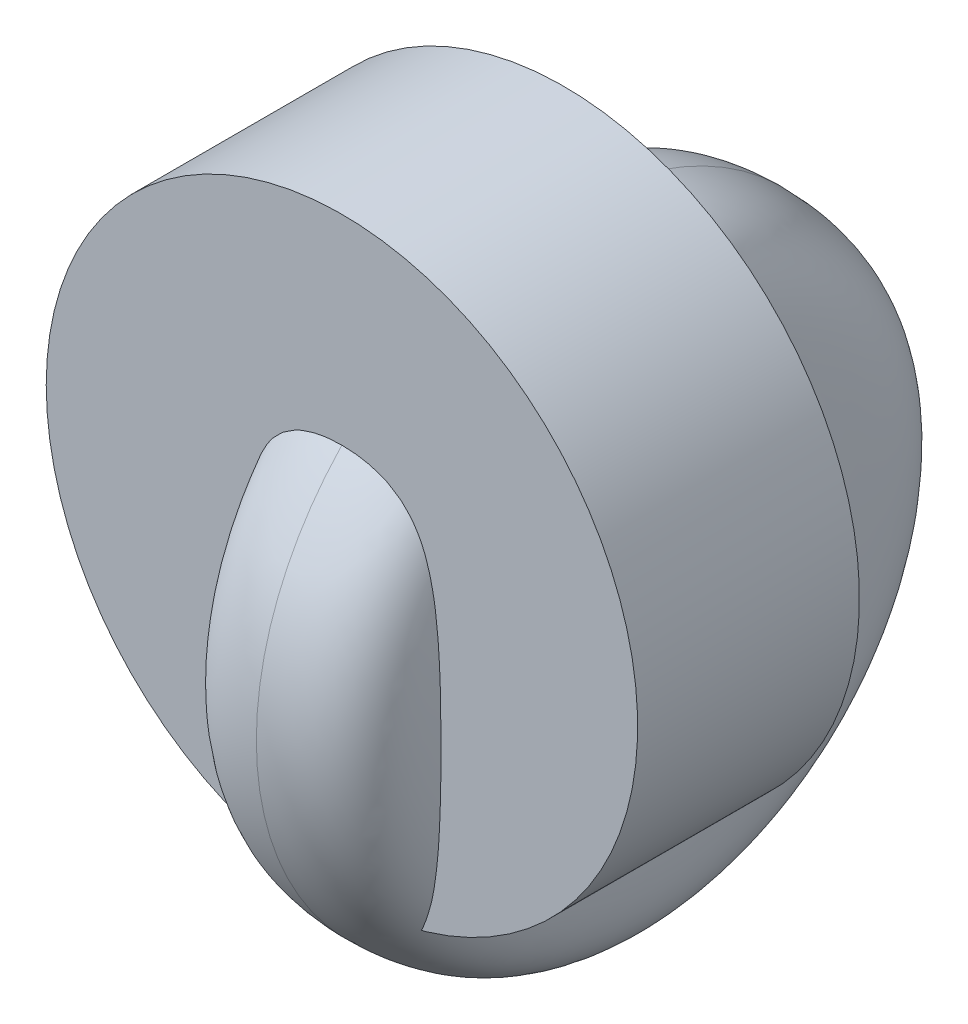
from build123d import *

# Parameters (mm, degrees)
SKETCH4_R           = 101.6
BOSS_EXTRUDE3_DEPTH = 76.2
SKETCH5_R           = 38.1
CUT_EXTRUDE2_DEPTH  = 58.42
SKETCH23_R          = 51.574588157
SKETCH23_R_2        = 41.91
BOSS_EXTRUDE4_DEPTH = 76.2
SKETCH24_R          = 41.91
SKETCH24_R_2        = 20.701
BOSS_EXTRUDE5_DEPTH = 76.2
SKETCH25_R          = 20.701
CUT_EXTRUDE8_DEPTH  = 76.2


with BuildPart() as part:
    # Sketch4 → Boss-Extrude3 (new body)
    with BuildSketch(Plane.XY):
        with Locations(Location((0, 0, 0), (0, 0, 180))):
            Circle(SKETCH4_R)
    extrude(amount=BOSS_EXTRUDE3_DEPTH)

    # Sketch5 → Cut-Extrude2 (cut)
    with BuildSketch(Plane(origin=(0, 0, 0), x_dir=(-1, 0, 0), z_dir=(0, 0, -1))):
        Circle(SKETCH5_R)
    extrude(amount=-CUT_EXTRUDE2_DEPTH, mode=Mode.SUBTRACT)

    # Sketch25 → Cut-Extrude8 (cut)
    with BuildSketch(Plane(origin=(0, 0, 58.42), x_dir=(-1, 0, 0), z_dir=(0, 0, -1))):
        Circle(SKETCH25_R)
    extrude(amount=-CUT_EXTRUDE8_DEPTH, mode=Mode.SUBTRACT)


with BuildPart() as body_2:
    # Sketch7 → Revolve1 (revolve)
    with BuildSketch(Plane.XY, mode=Mode.PRIVATE) as revolve1_sk:
        with BuildLine():
            add(Edge.make_bspline(
                [(-36.299897228, 11.377562293), (-32.448722286, 35.006020217), (-40.09873726, 64.973548254), (0, 65.416529242)],
                knots=[0.100344903, 0.100344903, 0.100344903, 0.100344903, 1, 1, 1, 1], degree=3))
            Line((-36.299897228, 11.377562293), (-28.589158758, 11.377562293))
            add(Edge.make_bspline(
                [(-28.589158758, 11.377562293), (-28.354156729, 12.973624821), (-27.97359185, 16.19996879), (-27.462206572, 22.508647188), (-27.03376106, 30.131869301), (-26.203620848, 38.415682211), (-24.84090542, 44.151470794), (-23.25766936, 47.829157442), (-21.819007149, 50.151715199), (-20.074150672, 52.119492902), (-17.870631716, 53.842742134), (-14.973619371, 55.365912568), (-11.793711756, 56.418392675), (-8.712012561, 57.071197566), (-6.121375383, 57.450555846), (-3.713532288, 57.662672887), (-1.649511644, 57.763018485), (-0.543810813, 57.789376019), (0, 57.796015422)],
                knots=[0.114375583, 0.114375583, 0.114375583, 0.114375583, 0.169683587, 0.224991591, 0.3356076, 0.446223608, 0.556839616, 0.61214762, 0.667455624, 0.722763628, 0.778071633, 0.833379637, 0.888687641, 0.916341643, 0.943995645, 0.971649647, 0.985476648, 0.999303649, 0.999303649, 0.999303649, 0.999303649], degree=3))
            Line((0, 57.796015422), (0, 65.416529242))
        make_face()
        with BuildLine():
            Line((28.589158758, 11.377562293), (36.299897228, 11.377562293))
            add(Edge.make_bspline(
                [(36.299897228, 11.377562293), (32.448722286, 35.006020217), (40.09873726, 64.973548254), (0, 65.416529242)],
                knots=[0.100344903, 0.100344903, 0.100344903, 0.100344903, 1, 1, 1, 1], degree=3))
            Line((0, 65.416529242), (0, 57.796015422))
            add(Edge.make_bspline(
                [(0, 57.796015422), (0.543810813, 57.789376019), (1.649511644, 57.763018485), (3.713532288, 57.662672887), (6.121375383, 57.450555846), (8.712012561, 57.071197566), (11.793711756, 56.418392675), (14.973619371, 55.365912568), (17.870631716, 53.842742134), (20.074150672, 52.119492902), (21.819007149, 50.151715199), (23.25766936, 47.829157442), (24.84090542, 44.151470794), (26.203620848, 38.415682211), (27.03376106, 30.131869301), (27.462206572, 22.508647188), (27.97359185, 16.19996879), (28.354156729, 12.973624821), (28.589158758, 11.377562293)],
                knots=[0.114375583, 0.114375583, 0.114375583, 0.114375583, 0.128202584, 0.142029585, 0.169683587, 0.197337589, 0.224991591, 0.280299595, 0.3356076, 0.390915604, 0.446223608, 0.501531612, 0.556839616, 0.667455624, 0.778071633, 0.888687641, 0.943995645, 0.999303649, 0.999303649, 0.999303649, 0.999303649], degree=3))
        make_face()
    revolve(revolve1_sk.sketch.rotate(Axis((-119.884766039, -40.197025864, 0), (1, 0, 0)), 90), axis=Axis((-119.884766039, -40.197025864, 0), (1, 0, 0)))

    # Sketch23 → Boss-Extrude4 (add)
    with BuildSketch(Plane(origin=(36.83, 0, 0), x_dir=(0, 0, -1), z_dir=(1, 0, 0))):
        with Locations((0, -40.197025864)):
            Circle(SKETCH23_R)
        with Locations((0, -40.197025864)):
            Circle(SKETCH23_R_2, mode=Mode.SUBTRACT)
    extrude(amount=-BOSS_EXTRUDE4_DEPTH)

    # Sketch24 → Boss-Extrude5 (add)
    with BuildSketch(Plane(origin=(36.83, 0, 0), x_dir=(0, 0, -1), z_dir=(1, 0, 0))):
        with Locations((0, -40.197025864)):
            Circle(SKETCH24_R)
        with Locations((0, -40.197025864)):
            Circle(SKETCH24_R_2, mode=Mode.SUBTRACT)
    extrude(amount=-BOSS_EXTRUDE5_DEPTH)


solid = Compound([part.part, body_2.part])
